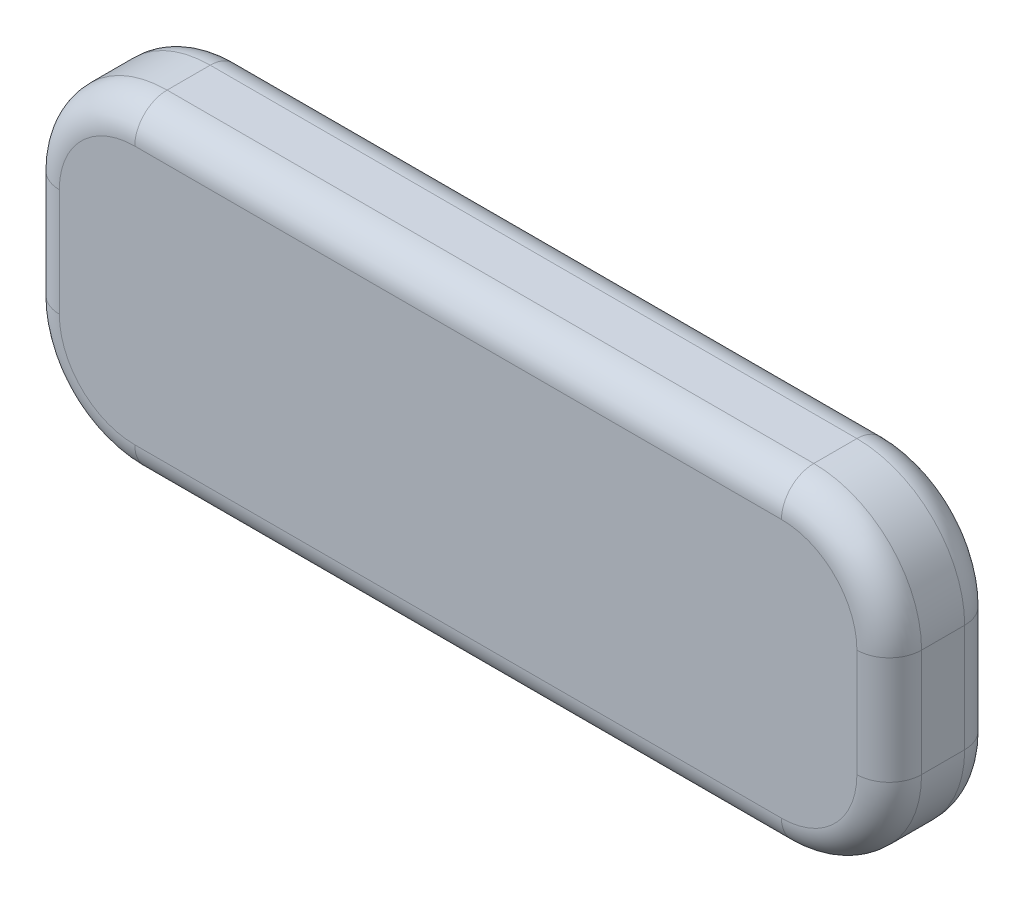
from build123d import *

# Parameters (mm, degrees)
SKETCH_1_W      = 80
SKETCH_1_H      = 30
EXTRUDE_1_DEPTH = 10
FILLET_1_R      = 10
FILLET_3_R      = 3


with BuildPart() as part:
    # 草图1 → 凸台-拉伸1 (new body)
    with BuildSketch(Plane.XY):
        Rectangle(SKETCH_1_W, SKETCH_1_H)
    extrude(amount=EXTRUDE_1_DEPTH)

    # 圆角1
    fillet_1_edges = [part.edges().sort_by_distance(p)[0] for p in [
        (-40, 15, 5),
        (40, 15, 5),
        (40, -15, 5),
        (-40, -15, 5),
    ]]
    fillet(fillet_1_edges, radius=FILLET_1_R)

    # 圆角3
    fillet_3_edges = [part.edges().sort_by_distance(p)[0] for p in [
        (40, 0, 0),
        (40, 0, 10),
        (-40, 0, 0),
        (0, 15, 0),
        (0, -15, 0),
        (-37.071067812, -12.071067812, 0),
        (-37.071067812, 12.071067812, 0),
        (37.071067812, 12.071067812, 0),
        (37.071067812, -12.071067812, 0),
        (0, -15, 10),
        (-40, 0, 10),
        (0, 15, 10),
        (-37.071067812, -12.071067812, 10),
        (-37.071067812, 12.071067812, 10),
        (37.071067812, 12.071067812, 10),
        (37.071067812, -12.071067812, 10),
    ]]
    fillet(fillet_3_edges, radius=FILLET_3_R)


solid = part.part
